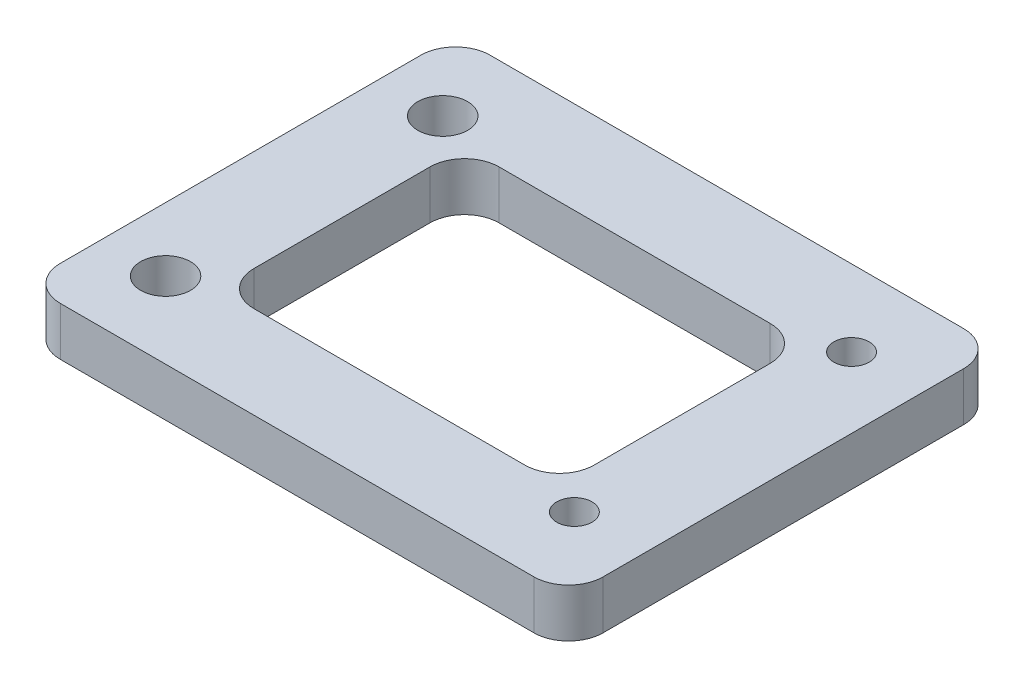
from build123d import *

# Parameters (mm, degrees)
SKETCH1_W           = 78.3542787
SKETCH1_H           = 62.038678242
SKETCH1_R           = 2.55
SKETCH1_R_2         = 3.6
SKETCH1_W_2         = 49.11576042
SKETCH1_H_2         = 35.409761762
BOSS_EXTRUDE1_DEPTH = 7
FILLET2_R           = 5


with BuildPart() as part:
    # Sketch1 → Boss-Extrude1 (new body)
    with BuildSketch(Plane(origin=(0, 0, 0), x_dir=(1, 0, 0), z_dir=(0, 1, 0))):
        Rectangle(SKETCH1_W, SKETCH1_H)
        with Locations(Location((29, 20, 0), (0, 0, 270))):
            Circle(SKETCH1_R, mode=Mode.SUBTRACT)
        with Locations(Location((29, -20, 0), (0, 0, 270))):
            Circle(SKETCH1_R, mode=Mode.SUBTRACT)
        with Locations(Location((-30, -20, 0), (0, 0, 270))):
            Circle(SKETCH1_R_2, mode=Mode.SUBTRACT)
        with Locations(Location((-30, 20, 0), (0, 0, 270))):
            Circle(SKETCH1_R_2, mode=Mode.SUBTRACT)
        Rectangle(SKETCH1_W_2, SKETCH1_H_2, mode=Mode.SUBTRACT)
    extrude(amount=BOSS_EXTRUDE1_DEPTH)

    # Fillet2
    fillet2_edges = [part.edges().sort_by_distance(p)[0] for p in [
        (24.55788021, 3.5, 17.704880881),
        (24.55788021, 3.5, -17.704880881),
        (-24.55788021, 3.5, -17.704880881),
        (-24.55788021, 3.5, 17.704880881),
        (39.17713935, 3.5, 31.019339121),
        (-39.17713935, 3.5, 31.019339121),
        (-39.17713935, 3.5, -31.019339121),
        (39.17713935, 3.5, -31.019339121),
    ]]
    fillet(fillet2_edges, radius=FILLET2_R)


solid = part.part
